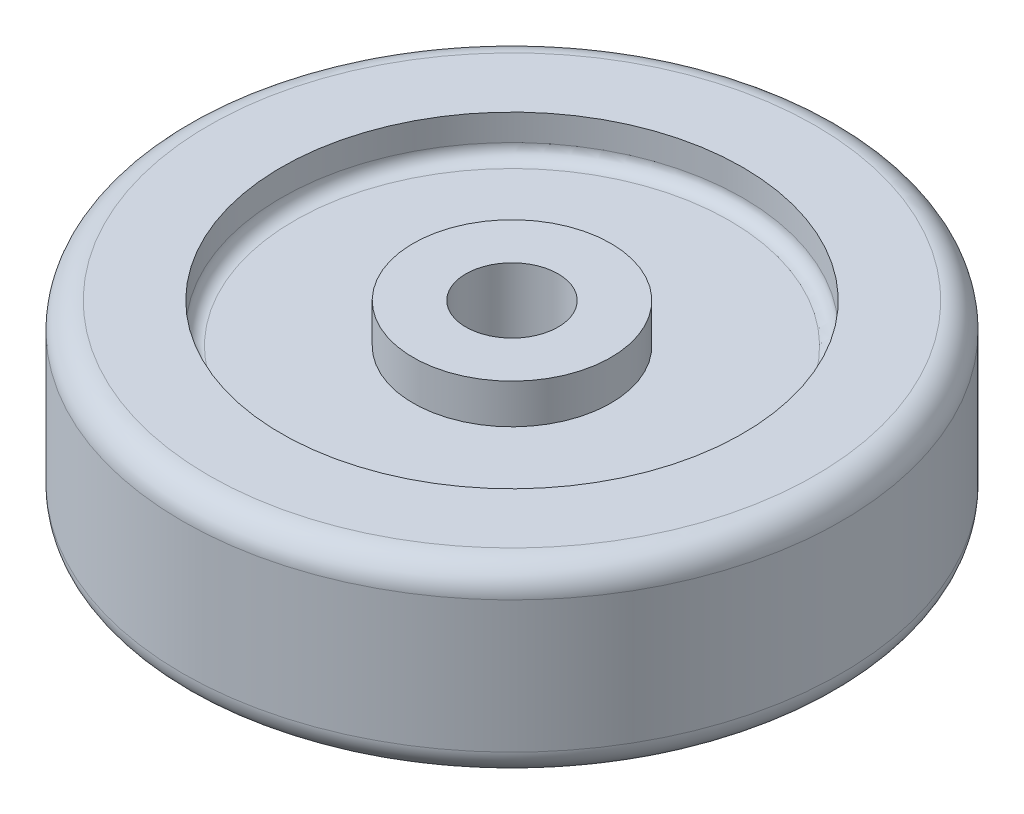
from build123d import *

# Parameters (mm, degrees)
FILLET_1_R = 4
FILLET_2_R = 2


with BuildPart() as part:
    # 草图1 → 旋转1 (revolve)
    with BuildSketch(Plane.XY, mode=Mode.PRIVATE) as revolve_1_sk:
        Polygon((-50, -14), (-50, 14), (-35, 14), (-35, 8), (-15, 8), (-15, 14), (-7, 14), (-7, -14), (-15, -14), (-15, -8), (-35, -8), (-35, -14), align=None)
    revolve(revolve_1_sk.sketch.rotate(Axis((0, 0, 0), (0, 1, 0)), 270), axis=Axis((0, 0, 0), (0, 1, 0)))

    # 圆角1
    fillet_1_edges = [part.edges().sort_by_distance(p)[0] for p in [
        (0, 14, 50),
        (0, -14, 50),
    ]]
    fillet(fillet_1_edges, radius=FILLET_1_R)

    # 圆角2
    fillet_2_edges = [part.edges().sort_by_distance(p)[0] for p in [
        (0, 8, 35),
    ]]
    fillet(fillet_2_edges, radius=FILLET_2_R)


solid = part.part
